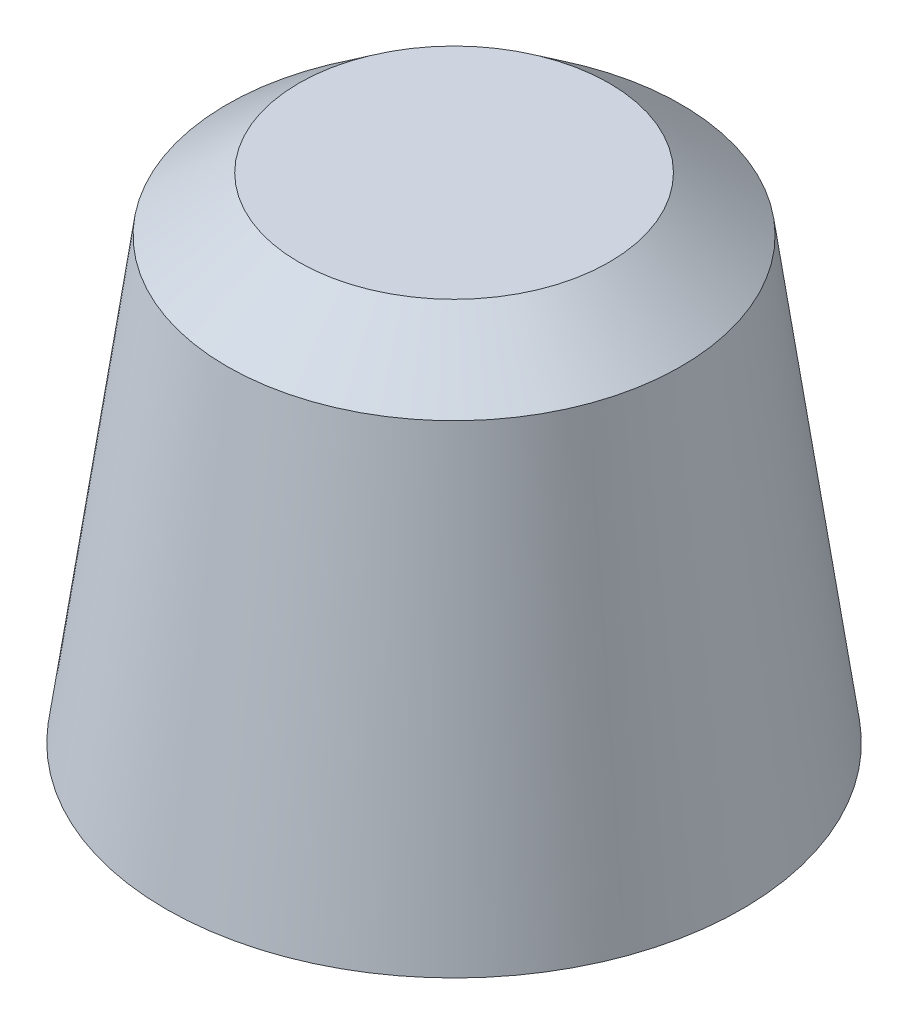
from build123d import *

# Parameters (mm, degrees)
SCHIZZO1_R               = 5.25
SCHIZZO2_R               = 4
SMUSSO1_SIZE             = 1
SMUSSO1_SIZE2            = 1.172437538
FORO_PER_VITE_M3_1_D     = 5.4
FORO_PER_VITE_M3_1_DEPTH = 7
FORO_PER_VITE_M3_1_TIP   = 1.622323671


with BuildPart() as part:
    # Schizzo1 → Loft1 section 0
    with BuildSketch(Plane(origin=(0, 0, 0), x_dir=(1, 0, 0), z_dir=(0, 1, 0))):
        Circle(SCHIZZO1_R)
    # Schizzo2 → Loft1 section 1
    with BuildSketch(Plane(origin=(0, 9, 0), x_dir=(1, 0, 0), z_dir=(0, 1, 0))):
        Circle(SCHIZZO2_R)
    loft()

    # Smusso1
    smusso1_edges = [part.edges().sort_by_distance(p)[0] for p in [
        (-4, 9, 0),
    ]]
    smusso1_side = [part.faces().sort_by_distance(p)[0] for p in [
        (-4.625, 4.5, 0),
    ]]
    chamfer(smusso1_edges, length=SMUSSO1_SIZE, length2=SMUSSO1_SIZE2, reference=smusso1_side[0])

    # Foro per Vite M3-1
    with Locations(Plane(origin=(0, 0, 0), x_dir=(-1, 0, 0), z_dir=(0, -1, 0))):
        with Locations((0, 0)):
            Hole(FORO_PER_VITE_M3_1_D / 2, depth=FORO_PER_VITE_M3_1_DEPTH)
            with Locations((0, 0, -(FORO_PER_VITE_M3_1_DEPTH + FORO_PER_VITE_M3_1_TIP / 2))):  # 118° drill point
                Cone(0, FORO_PER_VITE_M3_1_D / 2, FORO_PER_VITE_M3_1_TIP, mode=Mode.SUBTRACT)


solid = part.part
